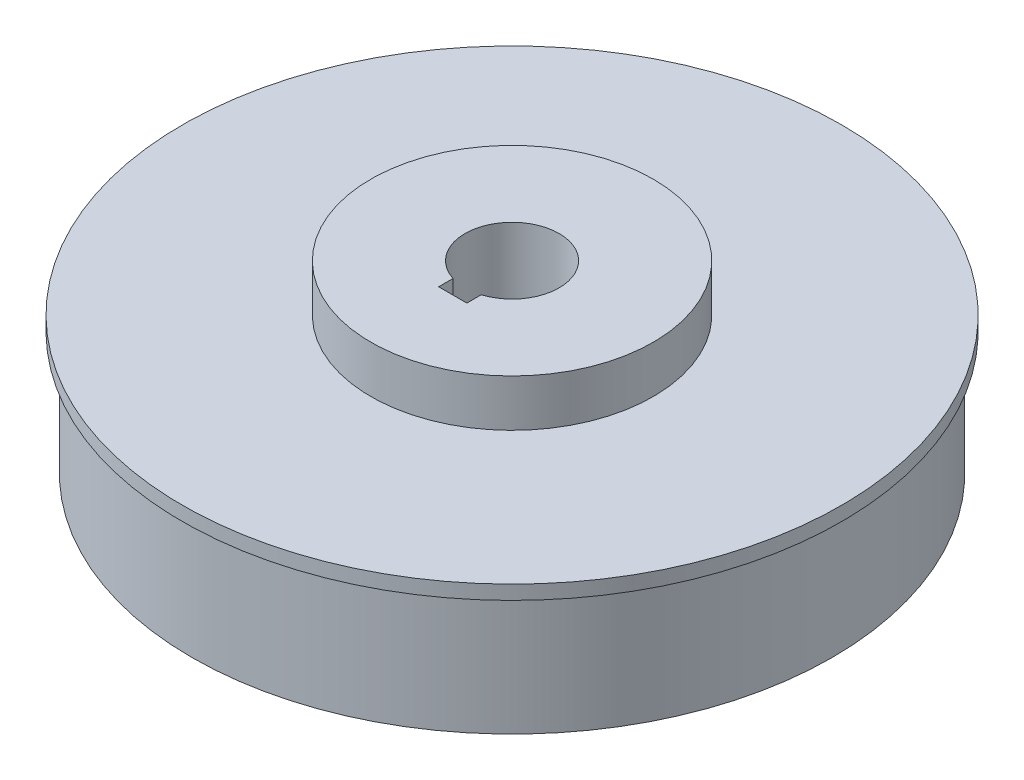
from build123d import *

# Parameters (mm, degrees)
SKETCH2_R          = 5
CUT_EXTRUDE1_DEPTH = 54.768020235
SKETCH3_W          = 3
SKETCH3_H          = 2
CUT_EXTRUDE2_DEPTH = 54.768020235


with BuildPart() as part:
    # Sketch1 → Revolve2 (revolve)
    with BuildSketch(Plane.XY, mode=Mode.PRIVATE) as revolve2_sk:
        Polygon((34, 14.5), (34, 1.5), (24, 1.5), (24, 0), (0, 0), (0, 21), (15, 21), (15, 16), (35, 16), (35, 14.5), align=None)
    revolve(revolve2_sk.sketch.rotate(Axis((0, 0, 0), (0, 1, 0)), 90), axis=Axis((0, 0, 0), (0, 1, 0)))

    # Sketch2 → Cut-Extrude1 (cut, through all)
    with BuildSketch(Plane(origin=(0, 21, 0), x_dir=(1, 0, 0), z_dir=(0, 1, 0))):
        with Locations(Location((0, 0, 0), (0, 0, 270))):
            Circle(SKETCH2_R)
    extrude(amount=-CUT_EXTRUDE1_DEPTH, mode=Mode.SUBTRACT)

    # Sketch3 → Cut-Extrude2 (cut, through all)
    with BuildSketch(Plane(origin=(0, 21, 0), x_dir=(1, 0, 0), z_dir=(0, 1, 0))):
        with Locations((0, -5.3)):
            Rectangle(SKETCH3_W, SKETCH3_H)
    extrude(amount=-CUT_EXTRUDE2_DEPTH, mode=Mode.SUBTRACT)


solid = part.part
